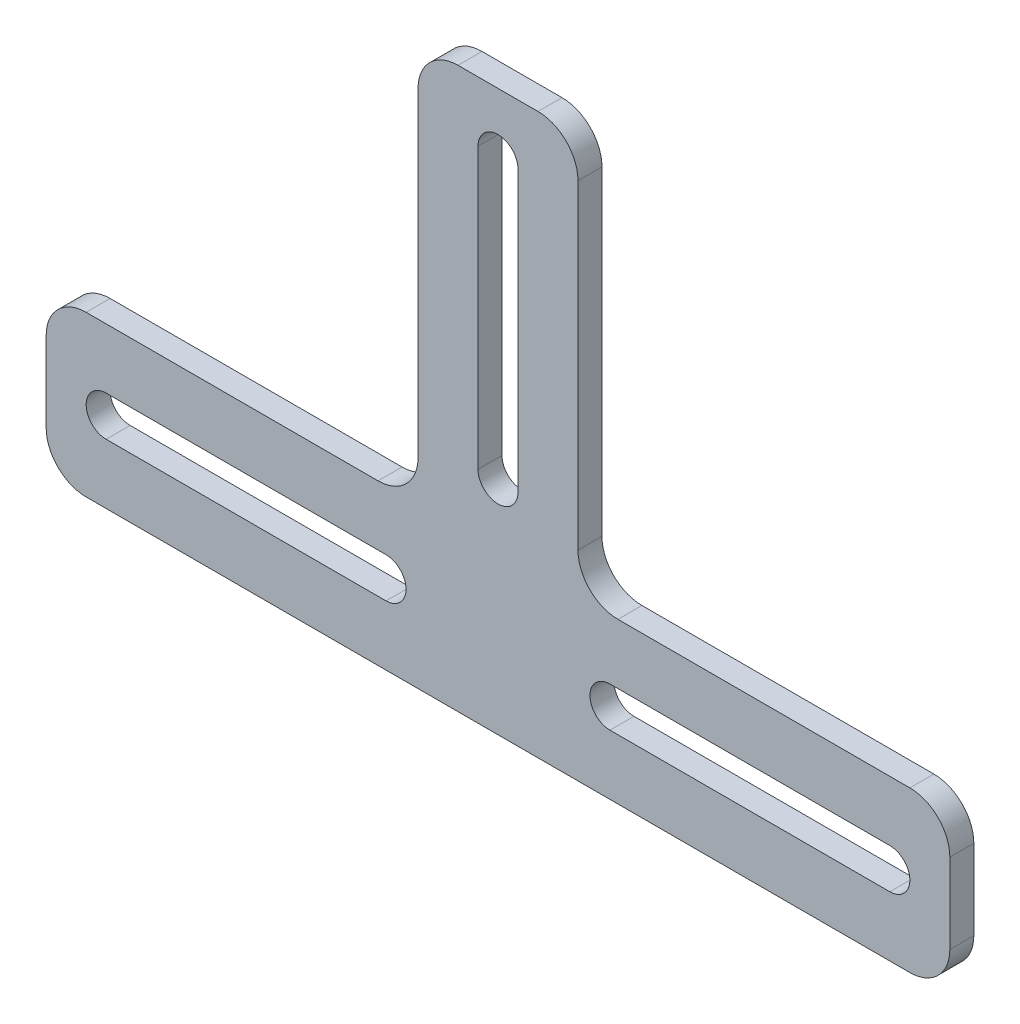
from build123d import *

# Parameters (mm, degrees)
BOSS_EXTRUDE1_DEPTH = 3
FILLET1_R           = 5


with BuildPart() as part:
    # Sketch1 → Boss-Extrude1 (new body)
    with BuildSketch(Plane.XY):
        Polygon((0, 0), (56.5, 0), (56.5, 20), (10, 20), (10, 70), (-10, 70), (-10, 20), (-56.5, 20), (-56.5, 0), align=None)
        with BuildLine():
            Line((2.5, 62.5), (2.5, 27.5))
            ThreePointArc((2.5, 27.5), (0, 25), (-2.5, 27.5))
            Line((-2.5, 27.5), (-2.5, 62.5))
            ThreePointArc((-2.5, 62.5), (0, 65), (2.5, 62.5))
        make_face(mode=Mode.SUBTRACT)
        with BuildLine():
            Line((49, 7.5), (14, 7.5))
            ThreePointArc((14, 7.5), (11.5, 10), (14, 12.5))
            Line((14, 12.5), (49, 12.5))
            ThreePointArc((49, 12.5), (51.5, 10), (49, 7.5))
        make_face(mode=Mode.SUBTRACT)
        with BuildLine():
            Line((-49, 7.5), (-14, 7.5))
            ThreePointArc((-14, 7.5), (-11.5, 10), (-14, 12.5))
            Line((-14, 12.5), (-49, 12.5))
            ThreePointArc((-49, 12.5), (-51.5, 10), (-49, 7.5))
        make_face(mode=Mode.SUBTRACT)
    extrude(amount=BOSS_EXTRUDE1_DEPTH)

    # Fillet1
    fillet1_edges = [part.edges().sort_by_distance(p)[0] for p in [
        (-10, 70, 1.5),
        (10, 70, 1.5),
        (10, 20, 1.5),
        (56.5, 20, 1.5),
        (56.5, 0, 1.5),
        (-56.5, 0, 1.5),
        (-56.5, 20, 1.5),
        (-10, 20, 1.5),
    ]]
    fillet(fillet1_edges, radius=FILLET1_R)


solid = part.part
